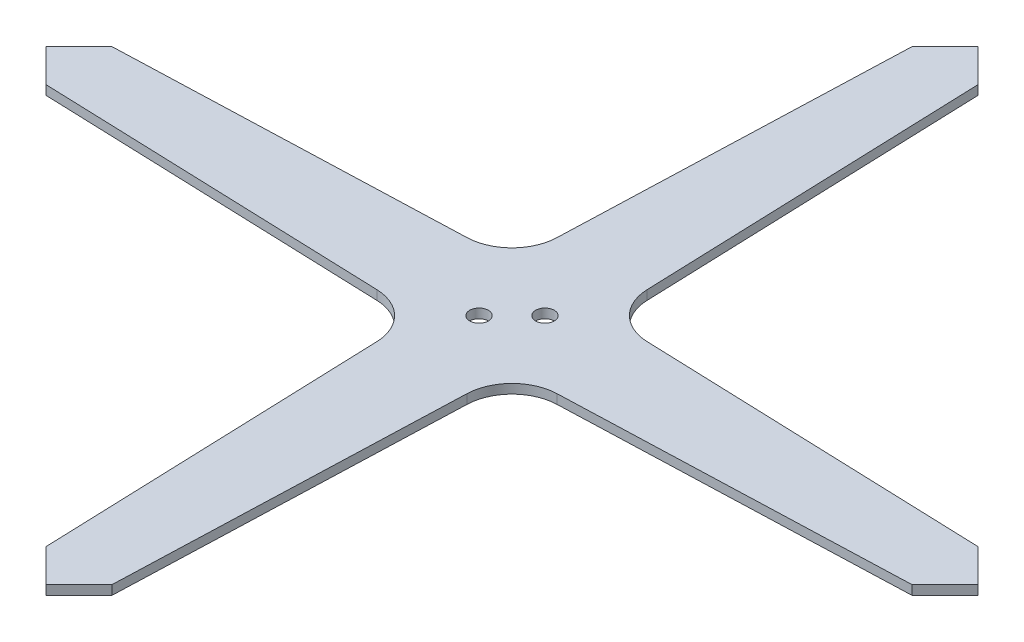
from build123d import *

# Parameters (mm, degrees)
SKETCH1_R           = 3
BOSS_EXTRUDE1_DEPTH = 3
FILLET1_R           = 15


with BuildPart() as part:
    # Sketch1 → Boss-Extrude1 (new body)
    with BuildSketch(Plane(origin=(0, 0, 0), x_dir=(1, 0, 0), z_dir=(0, 1, 0))):
        Polygon((-286.26, 15), (-410.653398282, 10.606601718), (-421.26, 0), (-410.653398282, -10.606601718), (-286.26, -15), (-281.866601718, -139.393398282), (-271.26, -150), (-260.653398282, -139.393398282), (-256.26, -15), (-131.866601718, -10.606601718), (-121.26, 0), (-131.866601718, 10.606601718), (-256.26, 15), (-260.653398282, 139.393398282), (-271.26, 150), (-281.866601718, 139.393398282), align=None)
        with Locations(Location((-276.563300859, -5.303300859, 0), (0, 0, 270))):
            Circle(SKETCH1_R, mode=Mode.SUBTRACT)
        with Locations(Location((-265.956699141, 5.303300859, 0), (0, 0, 270))):
            Circle(SKETCH1_R, mode=Mode.SUBTRACT)
    extrude(amount=BOSS_EXTRUDE1_DEPTH)

    # Fillet1
    fillet1_edges = [part.edges().sort_by_distance(p)[0] for p in [
        (-256.26, 1.5, -15),
        (-256.26, 1.5, 15),
        (-286.26, 1.5, 15),
        (-286.26, 1.5, -15),
    ]]
    fillet(fillet1_edges, radius=FILLET1_R)


solid = part.part
